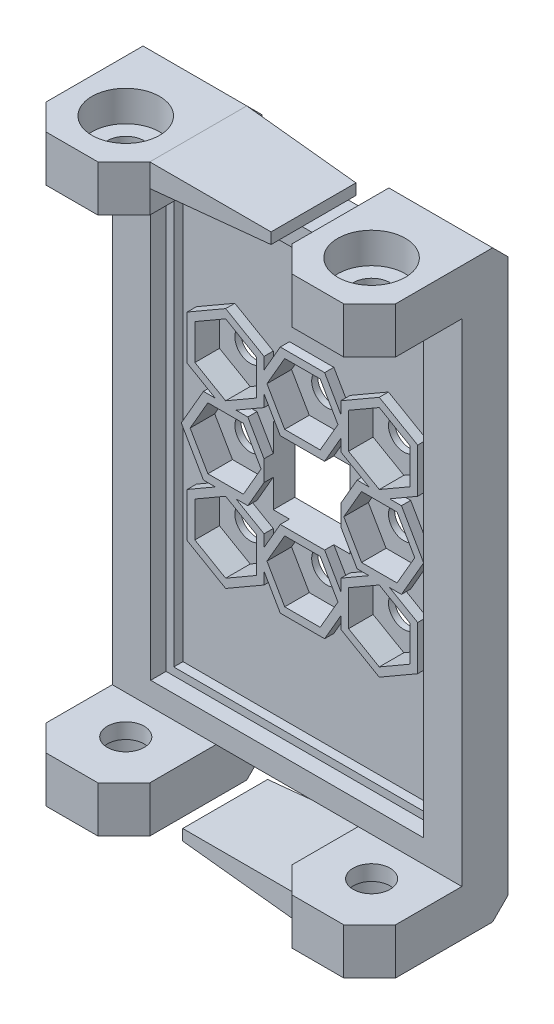
from build123d import *

# Parameters (mm, degrees)
SKETCH1_W                      = 22.75
SKETCH1_H                      = 38
BOSS_EXTRUDE1_DEPTH            = 3
SKETCH2_W                      = 22.75
SKETCH2_H                      = 3
BOSS_EXTRUDE2_DEPTH            = 6
CBORE_FOR_M2_SHCS1_D           = 2.4
CBORE_FOR_M2_SHCS1_DEPTH       = 3
CBORE_FOR_M2_SHCS1_CBORE_D     = 4.4
CBORE_FOR_M2_SHCS1_CBORE_DEPTH = 2
CBORE_FOR_M2_SHCS1_TIP         = 0.721032743
SKETCH4_W                      = 9.25
SKETCH4_H                      = 6
CUT_EXTRUDE5_DEPTH             = 41.674200976
CBORE_FOR_M2_SHCS2_D           = 2.4
CBORE_FOR_M2_SHCS2_CBORE_D     = 4.4
CBORE_FOR_M2_SHCS2_CBORE_DEPTH = 2
SKETCH5_W                      = 17.75
SKETCH5_H                      = 29
CUT_EXTRUDE3_DEPTH             = 1
CUT_EXTRUDE4_DEPTH             = 1.6
F_2_0_2_DIAMETER_HOLE1_D       = 2
F_2_0_2_DIAMETER_HOLE1_DEPTH   = 10
F_2_0_2_DIAMETER_HOLE1_TIP     = 0.600860619
SKETCH15_W                     = 5
SKETCH15_H                     = 5
CUT_EXTRUDE6_DEPTH             = 10
CUT_EXTRUDE7_DEPTH             = 41.674200976
SKETCH17_W                     = 9.25
SKETCH17_H                     = 3
CUT_EXTRUDE8_DEPTH             = 10
SKETCH20_W                     = 16.75
SKETCH20_H                     = 28
CUT_EXTRUDE9_DEPTH             = 0.6
CHAMFER1_SIZE                  = 1
SKETCH21_W                     = 6.312
SKETCH21_H                     = 1.5
BOSS_EXTRUDE3_DEPTH            = 7.5
BOSS_EXTRUDE3_TAPER            = 3
SKETCH22_W                     = 6.312
SKETCH22_H                     = 1.5
BOSS_EXTRUDE4_DEPTH            = 7.5
BOSS_EXTRUDE4_TAPER            = 3


with BuildPart() as part:
    # Sketch1 → Boss-Extrude1 (new body)
    with BuildSketch(Plane.XY):
        Rectangle(SKETCH1_W, SKETCH1_H)
    extrude(amount=BOSS_EXTRUDE1_DEPTH)

    # Sketch2 → Boss-Extrude2 (add)
    with BuildSketch(Plane.XY.offset(3)):
        with Locations((0, 17.5)):
            Rectangle(SKETCH2_W, SKETCH2_H)
        with Locations((0, -17.5)):
            Rectangle(SKETCH2_W, SKETCH2_H)
    extrude(amount=BOSS_EXTRUDE2_DEPTH)

    # CBORE for M2 SHCS1
    with Locations(Plane(origin=(0, 19, 0), x_dir=(-1, 0, 0), z_dir=(0, 1, 0))):
        with Locations((8, 5.5), (-8, 5.5)):
            CounterBoreHole(CBORE_FOR_M2_SHCS1_D / 2, CBORE_FOR_M2_SHCS1_CBORE_D / 2, CBORE_FOR_M2_SHCS1_CBORE_DEPTH, depth=CBORE_FOR_M2_SHCS1_DEPTH)
            with Locations((0, 0, -(CBORE_FOR_M2_SHCS1_DEPTH + CBORE_FOR_M2_SHCS1_TIP / 2))):  # 118° drill point
                Cone(0, CBORE_FOR_M2_SHCS1_D / 2, CBORE_FOR_M2_SHCS1_TIP, mode=Mode.SUBTRACT)

    # Sketch4 → Cut-Extrude5 (cut, through all)
    with BuildSketch(Plane(origin=(0, 19, 0), x_dir=(1, 0, 0), z_dir=(0, 1, 0))):
        with Locations((0, -6)):
            Rectangle(SKETCH4_W, SKETCH4_H)
    extrude(amount=-CUT_EXTRUDE5_DEPTH, mode=Mode.SUBTRACT)

    # CBORE for M2 SHCS2 (through all)
    with Locations(Plane.XZ.offset(19)):
        with Locations((-8, 5.5), (8, 5.5)):
            CounterBoreHole(CBORE_FOR_M2_SHCS2_D / 2, CBORE_FOR_M2_SHCS2_CBORE_D / 2, CBORE_FOR_M2_SHCS2_CBORE_DEPTH)

    # Sketch5 → Cut-Extrude3 (cut)
    with BuildSketch(Plane.XY.offset(3)):
        Rectangle(SKETCH5_W, SKETCH5_H)
    extrude(amount=-CUT_EXTRUDE3_DEPTH, mode=Mode.SUBTRACT)

    # Sketch6 → Cut-Extrude4 (cut)
    with BuildSketch(Plane.XY.offset(2)):
        Polygon((-3, 3.845299462), (-3, 6.154700538), (-5, 7.309401077), (-7, 6.154700538), (-7, 3.845299462), (-5, 2.690598923), align=None)
        Polygon((1.154700538, 3), (2.309401077, 5), (1.154700538, 7), (-1.154700538, 7), (-2.309401077, 5), (-1.154700538, 3), align=None)
        Polygon((5, 2.690598923), (7, 3.845299462), (7, 6.154700538), (5, 7.309401077), (3, 6.154700538), (3, 3.845299462), align=None)
        Polygon((-3.845299462, -2), (-2.690598923, 0), (-3.845299462, 2), (-6.154700538, 2), (-7.309401077, 0), (-6.154700538, -2), align=None)
        Polygon((0, -2.309401077), (2, -1.154700538), (2, 1.154700538), (0, 2.309401077), (-2, 1.154700538), (-2, -1.154700538), align=None)
        Polygon((7.309401077, 0), (6.154700538, 2), (3.845299462, 2), (2.690598923, 0), (3.845299462, -2), (6.154700538, -2), align=None)
        Polygon((-3, -6.154700538), (-3, -3.845299462), (-5, -2.690598923), (-7, -3.845299462), (-7, -6.154700538), (-5, -7.309401077), align=None)
        Polygon((1.154700538, -7), (2.309401077, -5), (1.154700538, -3), (-1.154700538, -3), (-2.309401077, -5), (-1.154700538, -7), align=None)
        Polygon((5, -7.309401077), (7, -6.154700538), (7, -3.845299462), (5, -2.690598923), (3, -3.845299462), (3, -6.154700538), align=None)
    extrude(amount=-CUT_EXTRUDE4_DEPTH, mode=Mode.SUBTRACT)

    # Ø2.0 (2) Diameter Hole1
    with Locations(Plane.XY.offset(0.4)):
        with Locations((-5, 5), (0, 5), (5, 5), (5, 0), (0, 0), (-5, 0), (-5, -5), (0, -5), (5, -5)):
            Hole(F_2_0_2_DIAMETER_HOLE1_D / 2, depth=F_2_0_2_DIAMETER_HOLE1_DEPTH)
            with Locations((0, 0, -(F_2_0_2_DIAMETER_HOLE1_DEPTH + F_2_0_2_DIAMETER_HOLE1_TIP / 2))):  # 118° drill point
                Cone(0, F_2_0_2_DIAMETER_HOLE1_D / 2, F_2_0_2_DIAMETER_HOLE1_TIP, mode=Mode.SUBTRACT)

    # Sketch15 → Cut-Extrude6 (cut)
    with BuildSketch(Plane.XY.offset(2)):
        Rectangle(SKETCH15_W, SKETCH15_H)
    extrude(amount=-CUT_EXTRUDE6_DEPTH, mode=Mode.SUBTRACT)

    # Sketch16 → Cut-Extrude7 (cut, through all)
    with BuildSketch(Plane(origin=(0, 19, 0), x_dir=(1, 0, 0), z_dir=(0, 1, 0))):
        Polygon((-4.625, -7.312), (-6.313, -9), (-4.625, -9), align=None)
        Polygon((-9.6875, -9), (-11.375, -7.312), (-11.375, -9), align=None)
        Polygon((6.313, -9), (4.625, -7.312), (4.625, -9), align=None)
        Polygon((11.375, -7.312), (9.687, -9), (11.375, -9), align=None)
    extrude(amount=-CUT_EXTRUDE7_DEPTH, mode=Mode.SUBTRACT)

    # Sketch17 → Cut-Extrude8 (cut)
    with BuildSketch(Plane.XY.offset(3)):
        with Locations((0, 17.5)):
            Rectangle(SKETCH17_W, SKETCH17_H)
        with Locations((0, -17.5)):
            Rectangle(SKETCH17_W, SKETCH17_H)
    extrude(amount=-CUT_EXTRUDE8_DEPTH, mode=Mode.SUBTRACT)

    # Sketch20 → Cut-Extrude9 (cut)
    # profile 1 of 5: a face of its own
    with BuildSketch(Plane.XY.offset(2)):
        Rectangle(SKETCH20_W, SKETCH20_H)
        Polygon((2.5, -5.669872981), (2.5, -6.443375673), (5, -7.886751346), (7.5, -6.443375673), (7.5, -3.556624327), (5.669872981, -2.5), (6.443375673, -2.5), (7.886751346, 0), (6.443375673, 2.5), (5.669872981, 2.5), (7.5, 3.556624327), (7.5, 6.443375673), (5, 7.886751346), (2.5, 6.443375673), (2.5, 5.669872981), (1.443375673, 7.5), (-1.443375673, 7.5), (-2.5, 5.669872981), (-2.5, 6.443375673), (-5, 7.886751346), (-7.5, 6.443375673), (-7.5, 3.556624327), (-5.669872981, 2.5), (-6.443375673, 2.5), (-7.886751346, 0), (-6.443375673, -2.5), (-5.669872981, -2.5), (-7.5, -3.556624327), (-7.5, -6.443375673), (-5, -7.886751346), (-2.5, -6.443375673), (-2.5, -5.669872981), (-1.443375673, -7.5), (1.443375673, -7.5), align=None, mode=Mode.SUBTRACT)
    # profile 2 of 5: a face of its own
    with BuildSketch(Plane.XY.offset(2)):
        Polygon((-3.556624327, 2.5), (-4.330127019, 2.5), (-2.5, 3.556624327), (-2.5, 4.330127019), (-1.443375673, 2.5), (-2.5, 2.5), (-2.5, 0.669872981), align=None)
    # profile 3 of 5: a face of its own
    with BuildSketch(Plane.XY.offset(2)):
        Polygon((4.330127019, 2.5), (3.556624327, 2.5), (2.5, 0.669872981), (2.5, 2.5), (1.443375673, 2.5), (2.5, 4.330127019), (2.5, 3.556624327), align=None)
    # profile 4 of 5: a face of its own
    with BuildSketch(Plane.XY.offset(2)):
        Polygon((4.330127019, -2.5), (2.5, -3.556624327), (2.5, -4.330127019), (1.443375673, -2.5), (2.5, -2.5), (2.5, -0.669872981), (3.556624327, -2.5), align=None)
    # profile 5 of 5: a face of its own
    with BuildSketch(Plane.XY.offset(2)):
        Polygon((-2.5, -4.330127019), (-2.5, -3.556624327), (-4.330127019, -2.5), (-3.556624327, -2.5), (-2.5, -0.669872981), (-2.5, -2.5), (-1.443375673, -2.5), align=None)
    extrude(amount=-CUT_EXTRUDE9_DEPTH, mode=Mode.SUBTRACT)

    # Chamfer1
    chamfer1_edges = [part.edges().sort_by_distance(p)[0] for p in [
        (-8, 19, 0),
        (-8, -19, 0),
        (8, -19, 0),
        (8, 19, 0),
    ]]
    chamfer(chamfer1_edges, length=CHAMFER1_SIZE)

    # Sketch21 → Boss-Extrude3 (add)
    with BuildSketch(Plane.ZY.offset(-4.625)):
        with Locations((4.156, -18.25)):
            Rectangle(SKETCH21_W, SKETCH21_H)
    extrude(amount=BOSS_EXTRUDE3_DEPTH, taper=BOSS_EXTRUDE3_TAPER)

    # Sketch22 → Boss-Extrude4 (add)
    with BuildSketch(Plane(origin=(-4.625, 0, 0), x_dir=(0, 0, -1), z_dir=(1, 0, 0))):
        with Locations((-4.156, 18.25)):
            Rectangle(SKETCH22_W, SKETCH22_H)
    extrude(amount=BOSS_EXTRUDE4_DEPTH, taper=BOSS_EXTRUDE4_TAPER)


solid = part.part
